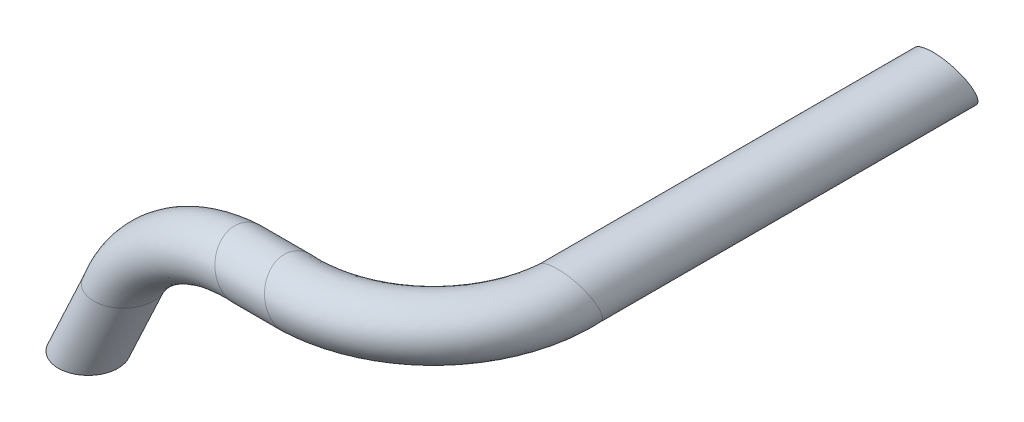
from build123d import *

# Parameters (mm, degrees)
SKETCH1_R = 1.75


with BuildPart() as part:
    # Sweep1: sweep along a curve in space
    with BuildLine() as sweep1_path:
        Line((0, 0, 0), (2.072282408, 4.444023964, 0))
        ThreePointArc((9.322744704, 9.06307787, 0), (5.024347837, 7.810209437, 0), (2.072282408, 4.444023964, 0))
        Line((9.322744704, 9.06307787, 0), (12.226182617, 9.06307787, 0))
        ThreePointArc((12.226182617, 9.06307787, 0), (17.883036867, 9.06307787, -2.343145751), (20.226182617, 9.06307787, -8))
        Line((20.226182617, 9.06307787, -8), (20.226182617, 9.06307787, -30))
    # Sketch1 → Sweep1 (sweep)
    with BuildSketch(Plane(origin=(0, 0, 0), x_dir=(1, 0, 0), z_dir=(0, 1, 0))):
        Circle(SKETCH1_R)
    sweep(path=sweep1_path.line)


solid = part.part
